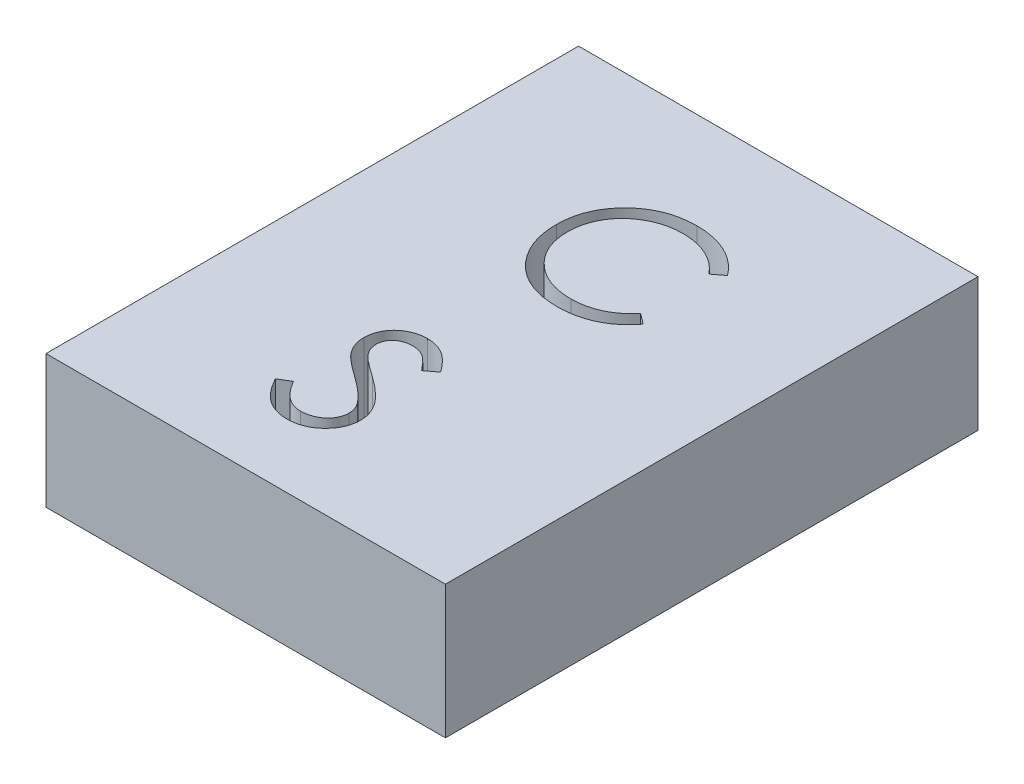
from build123d import *

# Parameters (mm, degrees)
SKETCH1_W           = 38.1
SKETCH1_H           = 50.8
BOSS_EXTRUDE1_DEPTH = 12.7
CUT_EXTRUDE1_DEPTH  = 65.757547823


with BuildPart() as part:
    # Sketch1 → Boss-Extrude1 (new body)
    with BuildSketch(Plane(origin=(0, 0, 0), x_dir=(1, 0, 0), z_dir=(0, 1, 0))):
        with Locations((19.05, 25.4)):
            Rectangle(SKETCH1_W, SKETCH1_H)
    extrude(amount=BOSS_EXTRUDE1_DEPTH)

    # Sketch2 → Cut-Extrude1 (cut, through all)
    with BuildSketch(Plane(origin=(0, 12.7, 0), x_dir=(1, 0, 0), z_dir=(0, 1, 0))):
        with BuildLine():
            Line((26.051282051, 38.94463141), (25.05400641, 38.181410256))
            add(Edge.make_bspline(
                [(25.05400641, 38.181410256), (24.982865044, 38.266195347), (24.841541451, 38.434622441), (24.614178059, 38.671131074), (24.377226384, 38.892710737), (24.130777001, 39.100416986), (23.87039391, 39.286986393), (23.602384726, 39.462141538), (23.322266105, 39.619141615), (22.934909811, 39.809507308), (22.428187619, 40.008157642), (21.790303488, 40.174720795), (21.124420359, 40.280751919), (20.670131926, 40.292235772), (20.4390625, 40.298076923)],
                knots=[0, 0, 0, 0, 0.757959112, 1.505699292, 2.245454638, 2.979532153, 3.711538275, 4.438200793, 5.171680507, 5.909471876, 7.393775596, 8.890124382, 10.418191784, 12, 12, 12, 12], degree=3))
            add(Edge.make_bspline(
                [(20.4390625, 40.298076923), (20.311760242, 40.296611116), (20.058337212, 40.293693107), (19.682241323, 40.255197138), (19.313168251, 40.201090747), (18.951358074, 40.120807432), (18.597271339, 40.019306785), (18.248593194, 39.898020283), (17.910371875, 39.747961293), (17.577928553, 39.582105607), (17.259415416, 39.394771736), (16.958044243, 39.190434716), (16.674914188, 38.971381138), (16.409801281, 38.73678998), (16.162434497, 38.487717724), (15.934606255, 38.22150997), (15.727104909, 37.939017797), (15.535817418, 37.64396629), (15.364502643, 37.337214875), (15.221065652, 37.017628191), (15.094047066, 36.690679017), (14.993538385, 36.352673376), (14.91398371, 36.005989626), (14.859091903, 35.649697338), (14.821033736, 35.284540843), (14.818130237, 35.03703848), (14.816666667, 34.912279647)],
                knots=[0, 0, 0, 0, 1.054917814, 2.100044995, 3.131103042, 4.146048494, 5.169673617, 6.183595914, 7.203665975, 8.234915748, 9.262203917, 10.264457458, 11.251630812, 12.227803204, 13.197192746, 14.159520551, 15.12972552, 16.100847026, 17.073214652, 18.039054194, 19.002613845, 19.979014051, 20.95965708, 21.949030935, 22.966165397, 24, 24, 24, 24], degree=3))
            add(Edge.make_bspline(
                [(14.816666667, 34.912279647), (14.821245267, 34.724568858), (14.830234742, 34.356023622), (14.910238697, 33.816198835), (15.031814314, 33.29905239), (15.214025122, 32.807816962), (15.438702819, 32.336435206), (15.722604467, 31.892882795), (16.051413045, 31.470456975), (16.429780224, 31.079141136), (16.8449099, 30.721677047), (17.290309465, 30.406896366), (17.764869594, 30.144496649), (18.26335051, 29.926143929), (18.789588123, 29.758298089), (19.34263612, 29.64013684), (19.921291646, 29.563058071), (20.316694897, 29.555678689), (20.517928686, 29.551923077)],
                knots=[0, 0, 0, 0, 1.029171465, 2.020641659, 2.987623507, 3.938342917, 4.889210282, 5.84687017, 6.821220943, 7.821438502, 8.827599549, 9.822697543, 10.807740252, 11.797342354, 12.80366471, 13.83203677, 14.896651826, 16, 16, 16, 16], degree=3))
            add(Edge.make_bspline(
                [(20.517928686, 29.551923077), (20.739644157, 29.558050935), (21.176033244, 29.570112025), (21.815997225, 29.672289872), (22.428629861, 29.837962888), (23.013964103, 30.069821063), (23.570349819, 30.371229394), (24.098657701, 30.736618835), (24.599333686, 31.169465071), (24.90040091, 31.499966708), (25.05400641, 31.668589744)],
                knots=[0, 0, 0, 0, 1.028121516, 2.023589091, 2.998037872, 3.967518031, 4.937445131, 5.927275754, 6.942489185, 8, 8, 8, 8], degree=3))
            Line((25.05400641, 31.668589744), (26.051282051, 30.913000801))
            add(Edge.make_bspline(
                [(26.051282051, 30.913000801), (25.97102491, 30.80944699), (25.810895054, 30.602835384), (25.551604535, 30.311563752), (25.278455484, 30.037591966), (24.989419051, 29.783128883), (24.687820207, 29.54308268), (24.368243531, 29.324273177), (24.034890184, 29.123646254), (23.688889647, 28.939942843), (23.330609537, 28.776957403), (22.960479159, 28.63742516), (22.580093928, 28.517229133), (22.189436455, 28.418343534), (21.787696423, 28.341159886), (21.37632356, 28.289562781), (20.954430012, 28.254213548), (20.669799713, 28.250991682), (20.525560897, 28.249358974)],
                knots=[0, 0, 0, 0, 0.986787822, 1.968848986, 2.935600012, 3.899624008, 4.868462664, 5.837806735, 6.815139263, 7.798259679, 8.787526145, 9.778297419, 10.776456485, 11.791383307, 12.812564526, 13.85620153, 14.913611965, 16, 16, 16, 16], degree=3))
            add(Edge.make_bspline(
                [(20.525560897, 28.249358974), (20.388968163, 28.250309633), (20.118872944, 28.252189443), (19.720097474, 28.282641022), (19.331878138, 28.32418721), (18.955324496, 28.386744257), (18.588381672, 28.460565148), (18.234376123, 28.559520851), (17.889824359, 28.670370684), (17.556110666, 28.800654493), (17.232951184, 28.947670355), (16.921388211, 29.113828297), (16.621565042, 29.297731064), (16.330533944, 29.495324958), (16.05259414, 29.712956882), (15.785337062, 29.947604385), (15.527264077, 30.198476595), (15.367597191, 30.379378492), (15.287319712, 30.470332532)],
                knots=[0, 0, 0, 0, 1.114604814, 2.203992996, 3.262667896, 4.300477797, 5.318619304, 6.316056647, 7.298880507, 8.271930387, 9.238335007, 10.195173496, 11.151986948, 12.108099108, 13.064862484, 14.031167946, 15.010108607, 16, 16, 16, 16], degree=3))
            add(Edge.make_bspline(
                [(15.287319712, 30.470332532), (15.158738948, 30.628324846), (14.903129761, 30.942402052), (14.57610228, 31.451439756), (14.296166866, 31.982910114), (14.069831382, 32.539605284), (13.892892321, 33.120276089), (13.770314842, 33.725215241), (13.690661877, 34.353857774), (13.681553115, 34.781436979), (13.676923077, 34.998778045)],
                knots=[0, 0, 0, 0, 0.994628077, 1.977248131, 2.950237994, 3.925870899, 4.908910175, 5.911660606, 6.938484602, 8, 8, 8, 8], degree=3))
            add(Edge.make_bspline(
                [(13.676923077, 34.998778045), (13.682566208, 35.227216405), (13.693668716, 35.676654617), (13.787996316, 36.33623439), (13.939738805, 36.96815518), (14.155264658, 37.571237339), (14.428515504, 38.148652928), (14.766069217, 38.695991014), (15.164004276, 39.216751972), (15.619199736, 39.70303407), (16.118372639, 40.147676864), (16.652929478, 40.538859375), (17.221823971, 40.86440579), (17.818788747, 41.136534722), (18.448293934, 41.345701774), (19.108996445, 41.492126194), (19.799654793, 41.583265445), (20.270869881, 41.594786913), (20.510296474, 41.600641026)],
                knots=[0, 0, 0, 0, 1.032925535, 2.032216505, 3.007276963, 3.968222605, 4.92396291, 5.891752235, 6.871517503, 7.883894988, 8.900124299, 9.891468569, 10.874487609, 11.85992873, 12.854644235, 13.869047385, 14.917252991, 16, 16, 16, 16], degree=3))
            add(Edge.make_bspline(
                [(20.510296474, 41.600641026), (20.656217558, 41.598891553), (20.945053648, 41.595428647), (21.372327559, 41.561660646), (21.788315431, 41.505368418), (22.193303851, 41.42874725), (22.589263059, 41.333652112), (22.97316679, 41.209771601), (23.347267739, 41.068124759), (23.70920652, 40.904989754), (24.057246574, 40.721867578), (24.391279501, 40.52078803), (24.708651988, 40.302000393), (25.011597238, 40.067365442), (25.29504749, 39.811919241), (25.567050569, 39.542687964), (25.818369338, 39.251916659), (25.97350236, 39.047247328), (26.051282051, 38.94463141)],
                knots=[0, 0, 0, 0, 1.096760587, 2.17092713, 3.219439832, 4.250915756, 5.268269357, 6.278326846, 7.281116186, 8.274029601, 9.260640565, 10.235837813, 11.203064059, 12.156899882, 13.114053108, 14.069676657, 15.032185724, 16, 16, 16, 16], degree=3))
        make_face()
        with BuildLine():
            Line((13.025641026, 8.858273237), (14.099238782, 9.501923077))
            add(Edge.make_bspline(
                [(14.099238782, 9.501923077), (14.199090672, 9.334775166), (14.390403038, 9.014526219), (14.709540827, 8.5817899), (15.040223105, 8.213990074), (15.384898687, 7.913266384), (15.741463698, 7.676506138), (16.112245836, 7.50885804), (16.495995607, 7.404297215), (16.757157759, 7.391596901), (16.887540064, 7.38525641)],
                knots=[0, 0, 0, 0, 1.272034388, 2.437168799, 3.508375237, 4.49857839, 5.41946034, 6.295179144, 7.148887113, 8, 8, 8, 8], degree=3))
            add(Edge.make_bspline(
                [(16.887540064, 7.38525641), (16.998889529, 7.388357651), (17.219640106, 7.394505867), (17.544623102, 7.45358192), (17.860242784, 7.544340216), (18.159994127, 7.674319025), (18.439741071, 7.831575816), (18.685056794, 8.02151766), (18.897132691, 8.234174463), (19.070611478, 8.471420096), (19.203707606, 8.726570892), (19.30600454, 8.988466487), (19.362773807, 9.261221006), (19.371325455, 9.444864686), (19.375641026, 9.537540064)],
                knots=[0, 0, 0, 0, 1.095163259, 2.171163733, 3.241058638, 4.321873601, 5.38011039, 6.391990106, 7.366004449, 8.327778327, 9.272591725, 10.192022065, 11.087607919, 12, 12, 12, 12], degree=3))
            add(Edge.make_bspline(
                [(19.375641026, 9.537540064), (19.370291384, 9.643279719), (19.359416344, 9.858232985), (19.267499259, 10.175368869), (19.122903421, 10.489213337), (18.989507542, 10.683346501), (18.920252404, 10.784134615)],
                knots=[0, 0, 0, 0, 0.938893495, 1.908633276, 2.914225137, 4, 4, 4, 4], degree=3))
            add(Edge.make_bspline(
                [(18.920252404, 10.784134615), (18.863390461, 10.856875947), (18.744015925, 11.009587273), (18.53879295, 11.236899985), (18.297978764, 11.471372533), (18.029814436, 11.721958254), (17.724531514, 11.977002545), (17.391691676, 12.248667439), (17.022797102, 12.526621733), (16.764081786, 12.713030757), (16.630588942, 12.809214744)],
                knots=[0, 0, 0, 0, 0.722233717, 1.516239348, 2.393582979, 3.351407094, 4.387010283, 5.505090956, 6.712668013, 8, 8, 8, 8], degree=3))
            add(Edge.make_bspline(
                [(16.630588942, 12.809214744), (16.496970442, 12.904387047), (16.241502044, 13.086349245), (15.884238045, 13.356403075), (15.564762422, 13.603305116), (15.284495134, 13.829379674), (15.043559454, 14.034657411), (14.840056791, 14.217167076), (14.679171169, 14.381844569), (14.589706634, 14.48867458), (14.549539263, 14.536638622)],
                knots=[0, 0, 0, 0, 1.452282411, 2.77665338, 3.964542531, 5.026858415, 5.96415736, 6.766646006, 7.446254459, 8, 8, 8, 8], degree=3))
            add(Edge.make_bspline(
                [(14.549539263, 14.536638622), (14.493396027, 14.611390956), (14.38298282, 14.758401452), (14.2372376, 14.988180222), (14.113361209, 15.22339607), (14.016252175, 15.464681065), (13.934477896, 15.708647807), (13.879476261, 15.95847947), (13.84503605, 16.213055028), (13.841509127, 16.384372587), (13.83974359, 16.470132212)],
                knots=[0, 0, 0, 0, 1.068054152, 2.10047183, 3.106115577, 4.101338837, 5.06977816, 6.043150881, 7.020423561, 8, 8, 8, 8], degree=3))
            add(Edge.make_bspline(
                [(13.83974359, 16.470132212), (13.844479634, 16.604497394), (13.853850492, 16.870355796), (13.933100369, 17.25872481), (14.058187726, 17.629515523), (14.233429176, 17.97905702), (14.459334429, 18.298247865), (14.720758393, 18.590759661), (15.0321315, 18.836662802), (15.373771019, 19.051517985), (15.747718426, 19.219687485), (16.139571132, 19.346545899), (16.549951937, 19.418425205), (16.827911882, 19.428740381), (16.968950321, 19.433974359)],
                knots=[0, 0, 0, 0, 1.005424448, 1.989358655, 2.955360095, 3.929531133, 4.905563448, 5.876582895, 6.856512386, 7.866279853, 8.892233794, 9.918561126, 10.94386622, 12, 12, 12, 12], degree=3))
            add(Edge.make_bspline(
                [(16.968950321, 19.433974359), (17.118607484, 19.428812529), (17.416227818, 19.418547296), (17.854012114, 19.329293397), (18.275509571, 19.181608102), (18.614575132, 19.014009258), (18.879942581, 18.846618121), (19.082317925, 18.694146187), (19.287395532, 18.51861365), (19.496829617, 18.319552957), (19.707071438, 18.095137603), (19.921242251, 17.846904532), (20.139842883, 17.576370743), (20.28047129, 17.383241841), (20.352564103, 17.284234776)],
                knots=[0, 0, 0, 0, 1.286793592, 2.559021753, 3.825965368, 5.121522368, 5.803751409, 6.523245864, 7.299691795, 8.125521123, 9.008227632, 9.944561021, 10.946284179, 12, 12, 12, 12], degree=3))
            Line((20.352564103, 17.284234776), (19.322215545, 16.503205128))
            add(Edge.make_bspline(
                [(19.322215545, 16.503205128), (19.260000304, 16.583355519), (19.140188297, 16.737706432), (18.958289873, 16.953865206), (18.786844779, 17.151319289), (18.617933329, 17.322824182), (18.460476437, 17.477771923), (18.307651741, 17.610431612), (18.161658524, 17.722103058), (17.977628591, 17.841278262), (17.746424299, 17.95941186), (17.456194696, 18.059375658), (17.152895927, 18.119446883), (16.946322692, 18.127389417), (16.841746795, 18.131410256)],
                knots=[0, 0, 0, 0, 1.181633172, 2.275549214, 3.290209073, 4.226197932, 5.078386478, 5.862611352, 6.581680152, 7.217281963, 8.414376989, 9.595101626, 10.782541182, 12, 12, 12, 12], degree=3))
            add(Edge.make_bspline(
                [(16.841746795, 18.131410256), (16.710550271, 18.127013517), (16.457550133, 18.118534818), (16.098356991, 18.025933729), (15.77507332, 17.880130978), (15.497296869, 17.675788058), (15.266022695, 17.43368617), (15.098725745, 17.15508861), (14.998032291, 16.847449606), (14.985744933, 16.632849882), (14.979487179, 16.523557692)],
                knots=[0, 0, 0, 0, 1.14458467, 2.207223713, 3.21896685, 4.227309161, 5.202851033, 6.127160689, 7.046193047, 8, 8, 8, 8], degree=3))
            add(Edge.make_bspline(
                [(14.979487179, 16.523557692), (14.980913668, 16.455516613), (14.983768976, 16.319323194), (15.023591814, 16.118113749), (15.074752236, 15.917412603), (15.155824071, 15.718122088), (15.267748458, 15.516756842), (15.414724382, 15.309849394), (15.599829829, 15.095576051), (15.74162356, 14.956212152), (15.816486378, 14.882632212)],
                knots=[0, 0, 0, 0, 0.858281714, 1.717966888, 2.583508476, 3.4729293, 4.427298488, 5.488583878, 6.674047936, 8, 8, 8, 8], degree=3))
            add(Edge.make_bspline(
                [(15.816486378, 14.882632212), (15.844286215, 14.857823575), (15.910332265, 14.798883933), (16.031076338, 14.702391944), (16.19052592, 14.583364741), (16.384517336, 14.436090764), (16.616627477, 14.265252316), (16.886881866, 14.073033781), (17.192268, 13.853195115), (17.408973237, 13.699497753), (17.523557692, 13.618229167)],
                knots=[0, 0, 0, 0, 0.420754252, 0.999615792, 1.744751191, 2.668019286, 3.750313428, 4.999500688, 6.413464383, 8, 8, 8, 8], degree=3))
            add(Edge.make_bspline(
                [(17.523557692, 13.618229167), (17.661392292, 13.517930519), (17.928289891, 13.323716089), (18.308047395, 13.03192205), (18.652376356, 12.746543004), (18.962485695, 12.469401402), (19.241439048, 12.202599464), (19.486141635, 11.942927353), (19.699086818, 11.692245417), (19.928337124, 11.3708535), (20.162589784, 10.976133566), (20.363763254, 10.492523957), (20.490612114, 10.007034451), (20.507200185, 9.680728502), (20.515384615, 9.519731571)],
                knots=[0, 0, 0, 0, 1.163667725, 2.253281268, 3.268753668, 4.215851969, 5.092017293, 5.902905408, 6.650798638, 7.335211899, 8.59617414, 9.77448103, 10.901945474, 12, 12, 12, 12], degree=3))
            add(Edge.make_bspline(
                [(20.515384615, 9.519731571), (20.513000143, 9.405872931), (20.508277502, 9.180366711), (20.453990758, 8.849241146), (20.374453687, 8.527637705), (20.254575724, 8.219531668), (20.108260264, 7.919286387), (19.922599879, 7.63477772), (19.707397709, 7.359708788), (19.460532333, 7.101414405), (19.190400059, 6.864301065), (18.904890653, 6.653375613), (18.603536805, 6.47750484), (18.287973313, 6.333991784), (17.958127692, 6.221747306), (17.614110876, 6.14042061), (17.255355792, 6.09050703), (17.011514045, 6.085326296), (16.887540064, 6.082692308)],
                knots=[0, 0, 0, 0, 0.983748083, 1.948392443, 2.894712957, 3.844097841, 4.80183111, 5.778335162, 6.776009319, 7.81870978, 8.863265674, 9.881300176, 10.883814829, 11.87499822, 12.874611388, 13.892143829, 14.928324115, 16, 16, 16, 16], degree=3))
            add(Edge.make_bspline(
                [(16.887540064, 6.082692308), (16.791617534, 6.084547167), (16.600980519, 6.088233524), (16.319006113, 6.120822742), (16.042728175, 6.166931375), (15.775613495, 6.240134429), (15.514220601, 6.328950889), (15.25968635, 6.438309981), (15.011887383, 6.569363826), (14.769435011, 6.719205773), (14.532945863, 6.893586732), (14.30463808, 7.096690562), (14.077020749, 7.32291568), (13.856812197, 7.578405438), (13.639558216, 7.859032196), (13.429542273, 8.167421519), (13.222417183, 8.501893631), (13.0924582, 8.737261228), (13.025641026, 8.858273237)],
                knots=[0, 0, 0, 0, 0.915332311, 1.819136955, 2.706846663, 3.586547465, 4.459518054, 5.340707479, 6.227863349, 7.133153174, 8.059268498, 9.028702269, 10.047606654, 11.120612155, 12.245963614, 13.433783089, 14.680604001, 16, 16, 16, 16], degree=3))
        make_face()
    extrude(amount=-CUT_EXTRUDE1_DEPTH, mode=Mode.SUBTRACT)


solid = part.part
